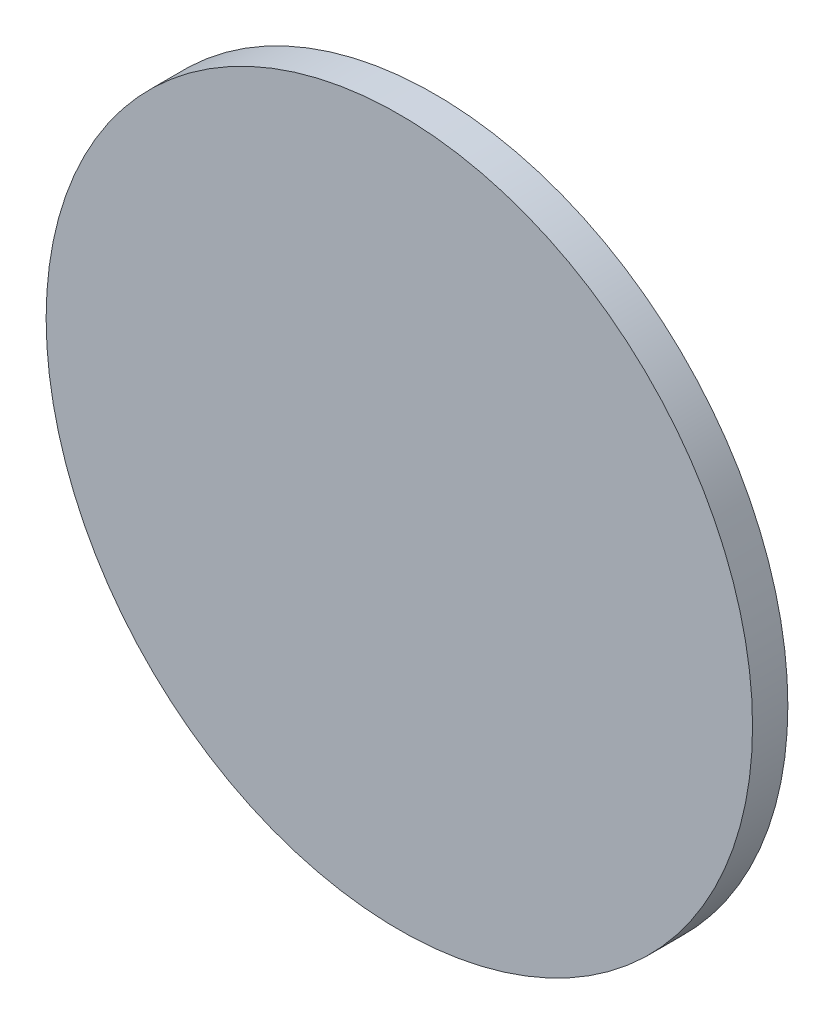
from build123d import *

# Parameters (mm, degrees)
SKETCH1_R           = 30
BOSS_EXTRUDE1_DEPTH = 3


with BuildPart() as part:
    # Sketch1 → Boss-Extrude1 (new body)
    with BuildSketch(Plane.XY):
        Circle(SKETCH1_R)
    extrude(amount=BOSS_EXTRUDE1_DEPTH)


solid = part.part
